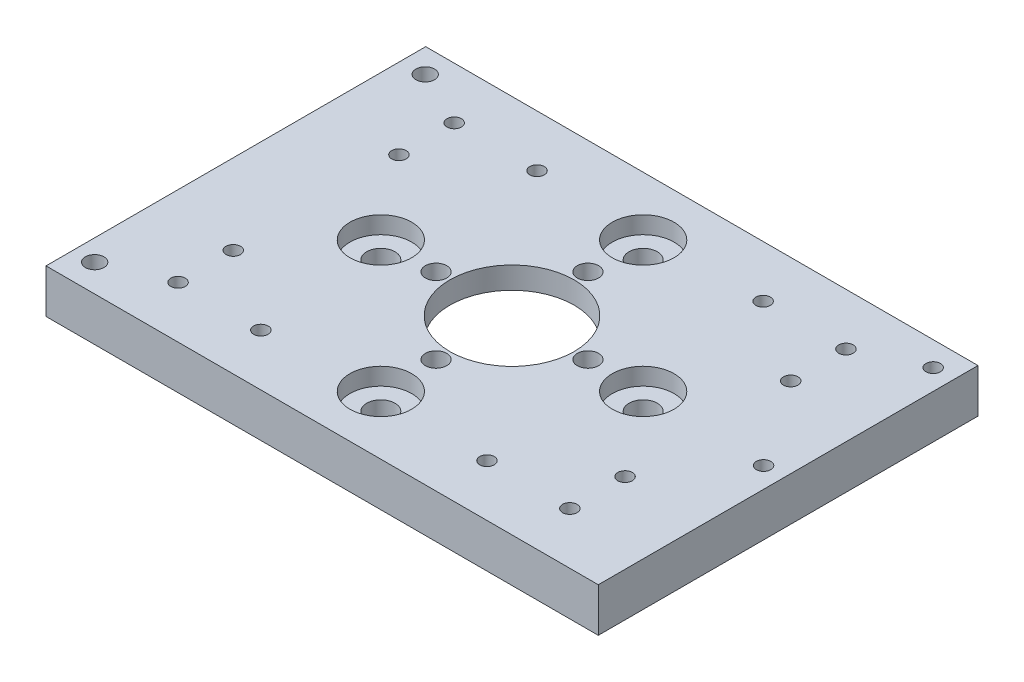
from build123d import *

# Parameters (mm, degrees)
SKETCH1_W           = 80
SKETCH1_H           = 55
SKETCH1_R           = 1.55
SKETCH1_R_2         = 2.05
SKETCH1_R_3         = 1.05
SKETCH1_R_4         = 1.35
SKETCH1_R_5         = 9
BOSS_EXTRUDE1_DEPTH = 6.35
SKETCH3_R           = 4.47
CUT_EXTRUDE2_DEPTH  = 2.5
SKETCH2_W           = 29
SKETCH2_H           = 29
CUT_EXTRUDE1_DEPTH  = 3.175
FILLET1_R           = 6.35


with BuildPart() as part:
    # Sketch1 → Boss-Extrude1 (new body)
    with BuildSketch(Plane(origin=(0, 0, 0), x_dir=(1, 0, 0), z_dir=(0, 1, 0))):
        Rectangle(SKETCH1_W, SKETCH1_H)
        with Locations(Location((0, 11, 0), (0, 0, 270))):
            Circle(SKETCH1_R, mode=Mode.SUBTRACT)
        with Locations(Location((11, 0, 0), (0, 0, 270))):
            Circle(SKETCH1_R, mode=Mode.SUBTRACT)
        with Locations(Location((0, -11, 0), (0, 0, 270))):
            Circle(SKETCH1_R, mode=Mode.SUBTRACT)
        with Locations(Location((-11, 0, 0), (0, 0, 270))):
            Circle(SKETCH1_R, mode=Mode.SUBTRACT)
        with Locations(Location((0, 19, 0), (0, 0, 270))):
            Circle(SKETCH1_R_2, mode=Mode.SUBTRACT)
        with Locations(Location((19, 0, 0), (0, 0, 270))):
            Circle(SKETCH1_R_2, mode=Mode.SUBTRACT)
        with Locations(Location((0, -19, 0), (0, 0, 270))):
            Circle(SKETCH1_R_2, mode=Mode.SUBTRACT)
        with Locations(Location((-19, 0, 0), (0, 0, 270))):
            Circle(SKETCH1_R_2, mode=Mode.SUBTRACT)
        with Locations(Location((37.017505191, 23.98740934, 0), (0, 0, 270))):
            Circle(SKETCH1_R_3, mode=Mode.SUBTRACT)
        with Locations(Location((-36.555321603, 23.98740934, 0), (0, 0, 270))):
            Circle(SKETCH1_R_4, mode=Mode.SUBTRACT)
        with Locations(Location((-36.939866092, -23.51259066, 0), (0, 0, 270))):
            Circle(SKETCH1_R_4, mode=Mode.SUBTRACT)
        with Locations(Location((0, 0, 0), (0, 0, 270))):
            Circle(SKETCH1_R_5, mode=Mode.SUBTRACT)
        with Locations(Location((16.375, -20, 0), (0, 0, 270))):
            Circle(SKETCH1_R_3, mode=Mode.SUBTRACT)
        with Locations(Location((28.375, -12, 0), (0, 0, 270))):
            Circle(SKETCH1_R_3, mode=Mode.SUBTRACT)
        with Locations(Location((28.375, -20, 0), (0, 0, 270))):
            Circle(SKETCH1_R_3, mode=Mode.SUBTRACT)
        with Locations(Location((28.375, 20, 0), (0, 0, 90))):
            Circle(SKETCH1_R_3, mode=Mode.SUBTRACT)
        with Locations(Location((28.375, 12, 0), (0, 0, 90))):
            Circle(SKETCH1_R_3, mode=Mode.SUBTRACT)
        with Locations(Location((16.375, 20, 0), (0, 0, 90))):
            Circle(SKETCH1_R_3, mode=Mode.SUBTRACT)
        with Locations(Location((-28.375, -20, 0), (0, 0, 90))):
            Circle(SKETCH1_R_3, mode=Mode.SUBTRACT)
        with Locations(Location((-28.375, -12, 0), (0, 0, 90))):
            Circle(SKETCH1_R_3, mode=Mode.SUBTRACT)
        with Locations(Location((-16.375, -20, 0), (0, 0, 90))):
            Circle(SKETCH1_R_3, mode=Mode.SUBTRACT)
        with Locations(Location((-16.375, 20, 0), (0, 0, 270))):
            Circle(SKETCH1_R_3, mode=Mode.SUBTRACT)
        with Locations(Location((-28.375, 12, 0), (0, 0, 270))):
            Circle(SKETCH1_R_3, mode=Mode.SUBTRACT)
        with Locations(Location((-28.375, 20, 0), (0, 0, 270))):
            Circle(SKETCH1_R_3, mode=Mode.SUBTRACT)
        with Locations(Location((37.017505191, -0.577084193, 0), (0, 0, 270))):
            Circle(SKETCH1_R_3, mode=Mode.SUBTRACT)
    extrude(amount=BOSS_EXTRUDE1_DEPTH)

    # Sketch3 → Cut-Extrude2 (cut)
    with BuildSketch(Plane(origin=(0, 6.35, 0), x_dir=(1, 0, 0), z_dir=(0, 1, 0))):
        with Locations(Location((0, -19, 0), (0, 0, 270))):
            Circle(SKETCH3_R)
        with Locations(Location((19, 0, 0), (0, 0, 270))):
            Circle(SKETCH3_R)
        with Locations(Location((-19, 0, 0), (0, 0, 270))):
            Circle(SKETCH3_R)
        with Locations(Location((0, 19, 0), (0, 0, 270))):
            Circle(SKETCH3_R)
    extrude(amount=-CUT_EXTRUDE2_DEPTH, mode=Mode.SUBTRACT)

    # Sketch2 → Cut-Extrude1 (cut)
    with BuildSketch(Plane.XZ):
        Rectangle(SKETCH2_W, SKETCH2_H)
    extrude(amount=-CUT_EXTRUDE1_DEPTH, mode=Mode.SUBTRACT)

    # Fillet1
    fillet1_edges = [part.edges().sort_by_distance(p)[0] for p in [
        (14.5, 1.5875, 14.5),
        (14.5, 1.5875, -14.5),
        (-14.5, 1.5875, -14.5),
        (-14.5, 1.5875, 14.5),
    ]]
    fillet(fillet1_edges, radius=FILLET1_R)


solid = part.part
